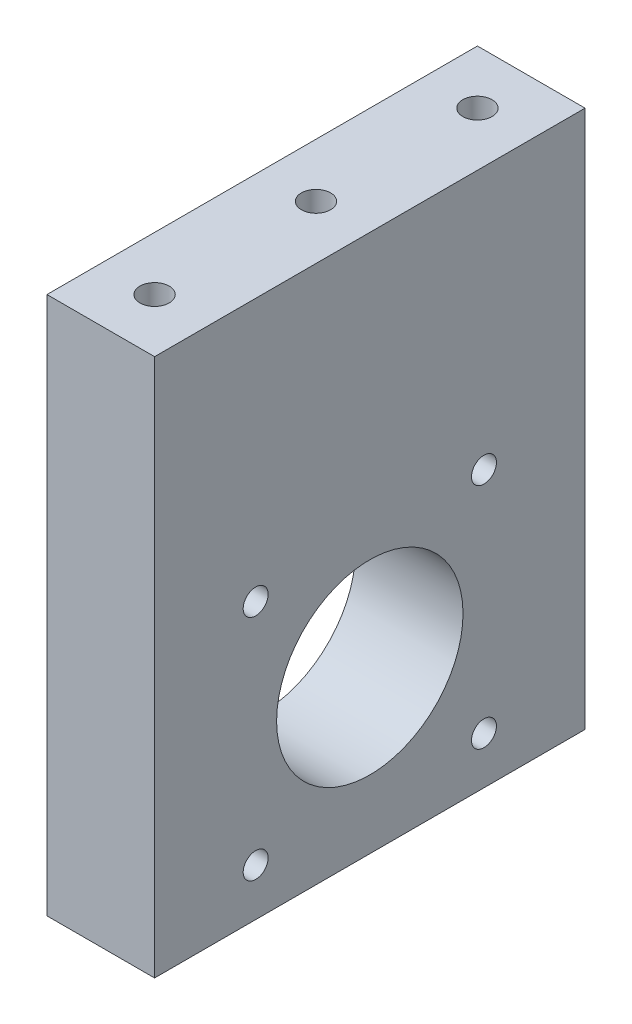
from build123d import *

# Parameters (mm, degrees)
SKETCH1_W                  = 50.8
SKETCH1_H                  = 63.5
BOSS_EXTRUDE1_DEPTH        = 12.7
F_22_0_22_DIAMETER_HOLE1_D = 22
F_8_32_TAPPED_HOLE1_D      = 3.4544
F_8_32_TAPPED_HOLE1_DEPTH  = 10.668
F_8_32_TAPPED_HOLE1_TIP    = 1.037806461
F_4_CLEARANCE_HOLE1_D      = 2.9464
CIRPATTERN1_COUNT          = 4


with BuildPart() as part:
    # Sketch1 → Boss-Extrude1 (new body)
    with BuildSketch(Plane(origin=(0, 0, 0), x_dir=(0, 0, -1), z_dir=(1, 0, 0))):
        Rectangle(SKETCH1_W, SKETCH1_H)
    extrude(amount=BOSS_EXTRUDE1_DEPTH)

    # Ø22.0 (22) Diameter Hole1 (through all)
    with Locations(Plane(origin=(12.7, 0, 0), x_dir=(0, 0, -1), z_dir=(1, 0, 0))):
        with Locations((0, -12.7)):
            Hole(F_22_0_22_DIAMETER_HOLE1_D / 2)

    # #8-32 Tapped Hole1
    with Locations(Plane(origin=(0, 31.75, 0), x_dir=(1, 0, 0), z_dir=(0, 1, 0))):
        with Locations((6.35, 19.05), (6.35, -19.05), (6.35, 0)):
            Hole(F_8_32_TAPPED_HOLE1_D / 2, depth=F_8_32_TAPPED_HOLE1_DEPTH)
            with Locations((0, 0, -(F_8_32_TAPPED_HOLE1_DEPTH + F_8_32_TAPPED_HOLE1_TIP / 2))):  # 118° drill point
                Cone(0, F_8_32_TAPPED_HOLE1_D / 2, F_8_32_TAPPED_HOLE1_TIP, mode=Mode.SUBTRACT)

    # #4 Clearance Hole1 (through all)
    with Locations(Plane.ZY):
        with Locations((-13.470384182, 0.770384182)):
            f_4_clearance_hole1 = Hole(F_4_CLEARANCE_HOLE1_D / 2)

    # CirPattern1: #4 Clearance Hole1 ×4 about axis
    cirpattern1_axis = Axis((0, -12.7, 0), (1, 0, 0))
    for i in range(1, CIRPATTERN1_COUNT):
        add(f_4_clearance_hole1.rotate(cirpattern1_axis, i * 360 / CIRPATTERN1_COUNT), mode=Mode.SUBTRACT)


solid = part.part
